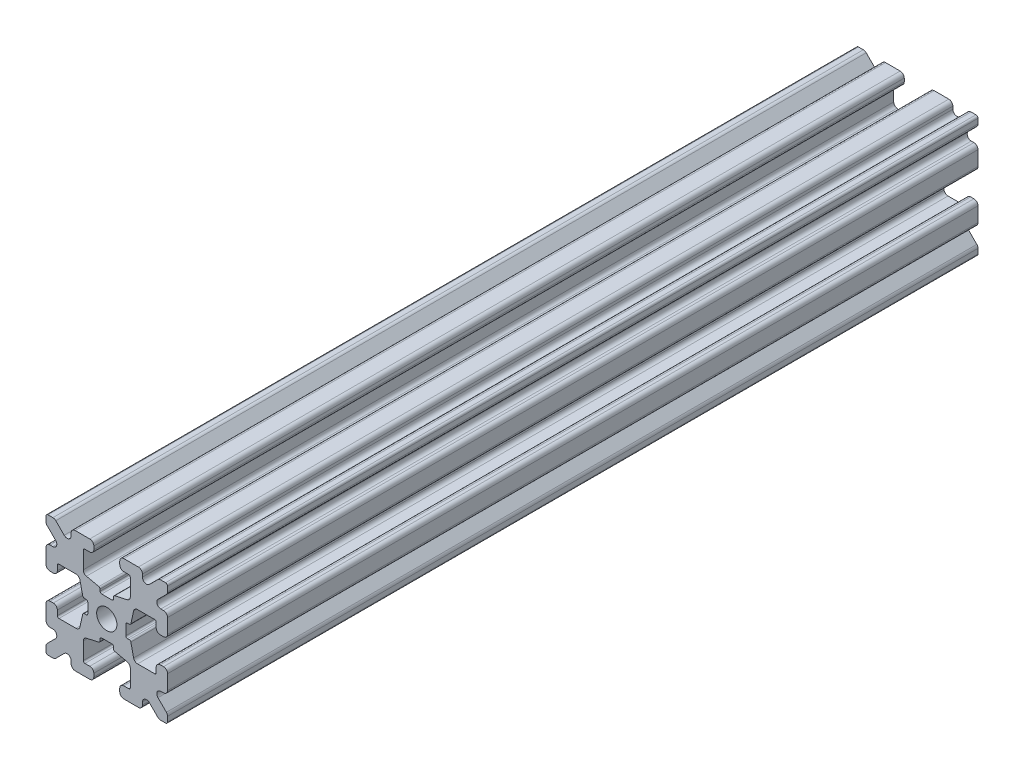
from build123d import *

# Parameters (mm, degrees)
SKETCH1_W           = 15
SKETCH1_H           = 15
SKETCH1_R           = 1.25
BOSS_EXTRUDE1_DEPTH = 50
FILLET1_R           = 0.25
CUT_EXTRUDE1_DEPTH  = 101.560926806
CUT_EXTRUDE3_DEPTH  = 101.560926806
FILLET3_R           = 0.5
FILLET4_R           = 0.5
FILLET5_R           = 3
FILLET6_R           = 0.2
CUT_EXTRUDE4_DEPTH  = 101.560926806
FILLET8_R           = 0.5
SKETCH6_W           = 5.1529354
SKETCH6_H           = 1.651
SKETCH6_W_2         = 1.651
SKETCH6_H_2         = 5.1529354
CUT_EXTRUDE5_DEPTH  = 101.560926806
FILLET10_R          = 0.2


with BuildPart() as part:
    # Sketch1 → Boss-Extrude1 (new, symmetric)
    with BuildSketch(Plane.XY):
        Rectangle(SKETCH1_W, SKETCH1_H)
        Circle(SKETCH1_R, mode=Mode.SUBTRACT)
    extrude(amount=BOSS_EXTRUDE1_DEPTH, both=True)

    # Fillet1
    fillet1_edges = [part.edges().sort_by_distance(p)[0] for p in [
        (7.5, -7.5, 0),
        (-7.5, -7.5, 0),
        (-7.5, 7.5, 0),
        (7.5, 7.5, 0),
    ]]
    fillet(fillet1_edges, radius=FILLET1_R)

    # Sketch2 → Cut-Extrude1 (cut, through all)
    with BuildSketch(Plane.XY.offset(50)):
        Polygon((-7.5, 1.6), (-6.1, 1.6), (-6.1, 2.9), (-3.4, 2.9), (-3.4, -2.9), (-6.1, -2.9), (-6.1, -1.6), (-7.5, -1.6), align=None)
        Polygon((2.9, 6.1), (1.6, 6.1), (1.6, 7.5), (-1.6, 7.5), (-1.6, 6.1), (-2.9, 6.1), (-2.9, 3.4), (2.9, 3.4), align=None)
        Polygon((-1.6, -7.5), (-1.6, -6.1), (-2.9, -6.1), (-2.9, -3.4), (2.9, -3.4), (2.9, -6.1), (1.6, -6.1), (1.6, -7.5), align=None)
        Polygon((6.1, -2.9), (6.1, -1.6), (7.5, -1.6), (7.5, 1.6), (6.1, 1.6), (6.1, 2.9), (3.4, 2.9), (3.4, -2.9), align=None)
    extrude(amount=-CUT_EXTRUDE1_DEPTH, mode=Mode.SUBTRACT)

    # Sketch4 → Cut-Extrude3 (cut, through all)
    with BuildSketch(Plane.XY.offset(50)):
        Polygon((-3.4, 2.9), (-2.75, 0), (-3.4, -2.9), align=None)
        Polygon((-2.9, 3.4), (0, 2.75), (2.9, 3.4), align=None)
        Polygon((3.4, 2.9), (2.75, 0), (3.4, -2.9), align=None)
        Polygon((-2.9, -3.4), (0, -2.75), (2.9, -3.4), align=None)
    extrude(amount=-CUT_EXTRUDE3_DEPTH, mode=Mode.SUBTRACT)

    # Fillet3
    fillet3_edges = [part.edges().sort_by_distance(p)[0] for p in [
        (1.6, -7.5, 0),
        (-1.6, -7.5, 0),
        (-1.6, -6.1, 0),
        (1.6, -6.1, 0),
        (6.1, 1.6, 0),
        (7.5, 1.6, 0),
        (7.5, -1.6, 0),
        (6.1, -1.6, 0),
        (-7.5, -1.6, 0),
        (-7.5, 1.6, 0),
        (-6.1, 1.6, 0),
        (-6.1, -1.6, 0),
        (-1.6, 6.1, 0),
        (-1.6, 7.5, 0),
        (1.6, 7.5, 0),
        (1.6, 6.1, 0),
    ]]
    fillet(fillet3_edges, radius=FILLET3_R)

    # Fillet4
    fillet4_edges = [part.edges().sort_by_distance(p)[0] for p in [
        (-2.9, -3.4, 0),
        (2.9, -3.4, 0),
        (3.4, -2.9, 0),
        (3.4, 2.9, 0),
        (-3.4, 2.9, 0),
        (-3.4, -2.9, 0),
        (2.9, 3.4, 0),
        (-2.9, 3.4, 0),
    ]]
    fillet(fillet4_edges, radius=FILLET4_R)

    # Fillet5
    fillet5_edges = [part.edges().sort_by_distance(p)[0] for p in [
        (-2.75, 0, 0),
        (0, 2.75, 0),
        (2.75, 0, 0),
        (0, -2.75, 0),
    ]]
    fillet(fillet5_edges, radius=FILLET5_R)

    # Fillet6
    fillet6_edges = [part.edges().sort_by_distance(p)[0] for p in [
        (-2.9, -6.1, 0),
        (2.9, -6.1, 0),
        (6.1, -2.9, 0),
        (6.1, 2.9, 0),
        (-6.1, 2.9, 0),
        (-6.1, -2.9, 0),
        (2.9, 6.1, 0),
        (-2.9, 6.1, 0),
    ]]
    fillet(fillet6_edges, radius=FILLET6_R)

    # Sketch5 → Cut-Extrude4 (cut, through all)
    with BuildSketch(Plane.XY.offset(50)):
        Polygon((-7.5, 6.439339828), (-5.460660172, 4.4), (-7.5, 4.4), align=None)
        Polygon((-6.439339828, 7.5), (-4.4, 5.460660172), (-4.4, 7.5), align=None)
        Polygon((4.4, 7.5), (6.439339828, 7.5), (4.4, 5.460660172), align=None)
        Polygon((7.5, 6.439339828), (7.5, 4.4), (5.460660172, 4.4), align=None)
        Polygon((7.5, -6.439339828), (5.460660172, -4.4), (7.5, -4.4), align=None)
        Polygon((6.439339828, -7.5), (4.4, -5.460660172), (4.4, -7.5), align=None)
        Polygon((-4.4, -7.5), (-6.439339828, -7.5), (-4.4, -5.460660172), align=None)
        Polygon((-7.5, -6.439339828), (-7.5, -4.4), (-5.460660172, -4.4), align=None)
    extrude(amount=-CUT_EXTRUDE4_DEPTH, mode=Mode.SUBTRACT)

    # Fillet8
    fillet8_edges = [part.edges().sort_by_distance(p)[0] for p in [
        (-7.5, 4.4, 0),
        (-7.5, 6.439339828, 0),
        (-5.460660172, 4.4, 0),
        (7.5, -4.4, 0),
        (7.5, -6.439339828, 0),
        (5.460660172, -4.4, 0),
        (5.460660172, 4.4, 0),
        (7.5, 6.439339828, 0),
        (7.5, 4.4, 0),
        (-4.4, 7.5, 0),
        (-4.4, 5.460660172, 0),
        (-6.439339828, 7.5, 0),
        (-5.460660172, -4.4, 0),
        (-7.5, -6.439339828, 0),
        (-7.5, -4.4, 0),
        (4.4, 5.460660172, 0),
        (4.4, 7.5, 0),
        (6.439339828, 7.5, 0),
        (6.439339828, -7.5, 0),
        (4.4, -7.5, 0),
        (4.4, -5.460660172, 0),
        (-6.439339828, -7.5, 0),
        (-4.4, -5.460660172, 0),
        (-4.4, -7.5, 0),
    ]]
    fillet(fillet8_edges, radius=FILLET8_R)

    # Sketch6 → Cut-Extrude5 (cut, through all)
    with BuildSketch(Plane.XY.offset(50)):
        with Locations((4.9235323, 0)):
            Rectangle(SKETCH6_W, SKETCH6_H)
        with Locations((0, -4.9235323)):
            Rectangle(SKETCH6_W_2, SKETCH6_H_2)
        with Locations((-4.9235323, 0)):
            Rectangle(SKETCH6_W, SKETCH6_H)
        with Locations((0, 4.9235323)):
            Rectangle(SKETCH6_W_2, SKETCH6_H_2)
    extrude(amount=-CUT_EXTRUDE5_DEPTH, mode=Mode.SUBTRACT)

    # Fillet10
    fillet10_edges = [part.edges().sort_by_distance(p)[0] for p in [
        (0.8255, -2.935025862, 0),
        (-0.8255, -2.935025862, 0),
        (0.8255, -2.3470646, 0),
        (-0.8255, -2.3470646, 0),
        (2.935025862, 0.8255, 0),
        (2.935025862, -0.8255, 0),
        (2.3470646, 0.8255, 0),
        (2.3470646, -0.8255, 0),
        (-2.935025862, -0.8255, 0),
        (-2.935025862, 0.8255, 0),
        (-2.3470646, -0.8255, 0),
        (-2.3470646, 0.8255, 0),
        (-0.8255, 2.935025862, 0),
        (0.8255, 2.935025862, 0),
        (-0.8255, 2.3470646, 0),
        (0.8255, 2.3470646, 0),
    ]]
    fillet(fillet10_edges, radius=FILLET10_R)


solid = part.part
